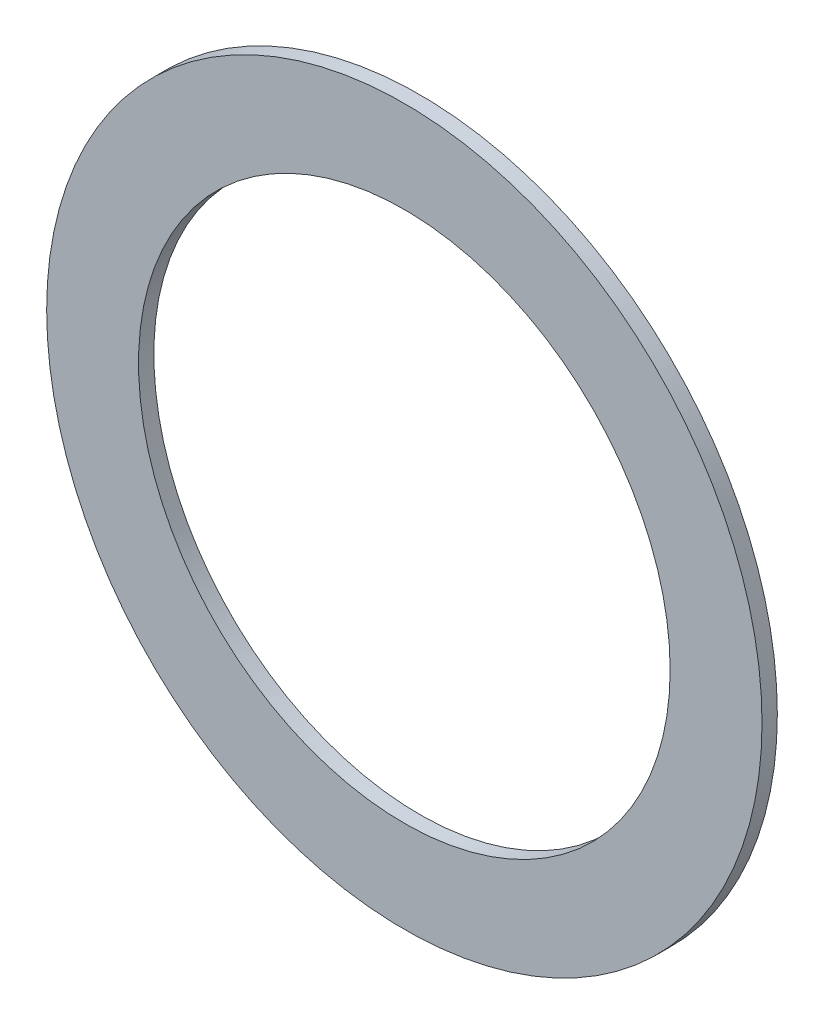
from build123d import *

# Parameters (mm, degrees)
SKETCH1_R           = 116.8
SKETCH1_R_2         = 86.8
EXTRUDE_THIN1_DEPTH = 2.5


with BuildPart() as part:
    # Sketch1 → Extrude-Thin1 (new, symmetric)
    with BuildSketch(Plane.XY):
        Circle(SKETCH1_R)
        Circle(SKETCH1_R_2, mode=Mode.SUBTRACT)
    extrude(amount=EXTRUDE_THIN1_DEPTH, both=True)


solid = part.part
